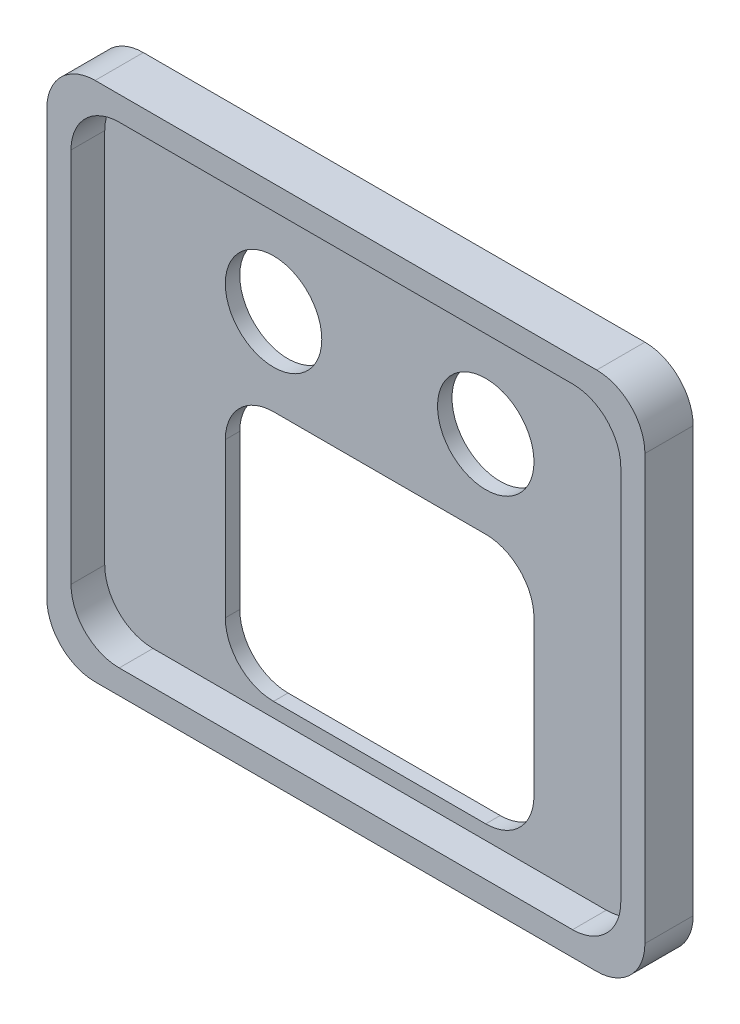
from build123d import *

# Parameters (mm, degrees)
EXTRUDE_1_DEPTH     = 10
CUT_EXTRUDE_1_DEPTH = 7
CUT_EXTRUDE_2_DEPTH = 7
SKETCH_4_R          = 10
CUT_EXTRUDE_3_DEPTH = 7


with BuildPart() as part:
    # 草图1 → 凸台-拉伸1 (new body)
    with BuildSketch(Plane.XY):
        with BuildLine():
            Line((10, 108), (114, 108))
            ThreePointArc((114, 108), (121.071067812, 105.071067812), (124, 98))
            Line((124, 98), (124, 10))
            ThreePointArc((124, 10), (121.071067812, 2.928932188), (114, 0))
            Line((114, 0), (10, 0))
            ThreePointArc((10, 0), (2.928932188, 2.928932188), (0, 10))
            Line((0, 10), (0, 98))
            ThreePointArc((0, 98), (2.928932188, 105.071067812), (10, 108))
        make_face()
    extrude(amount=EXTRUDE_1_DEPTH)

    # 草图2 → 切除-拉伸1 (cut)
    with BuildSketch(Plane.XY.offset(10)):
        with BuildLine():
            Line((15, 103), (109, 103))
            ThreePointArc((109, 103), (116.071067812, 100.071067812), (119, 93))
            Line((119, 93), (119, 15))
            ThreePointArc((119, 15), (116.071067812, 7.928932188), (109, 5))
            Line((109, 5), (15, 5))
            ThreePointArc((15, 5), (7.928932188, 7.928932188), (5, 15))
            Line((5, 15), (5, 93))
            ThreePointArc((5, 93), (7.928932188, 100.071067812), (15, 103))
        make_face()
    extrude(amount=-CUT_EXTRUDE_1_DEPTH, mode=Mode.SUBTRACT)

    # 草图3 → 切除-拉伸2 (cut)
    with BuildSketch(Plane(origin=(0, 0, 0), x_dir=(-1, 0, 0), z_dir=(0, 0, -1))):
        with BuildLine():
            Line((-84, 60), (-40, 60))
            ThreePointArc((-40, 60), (-32.928932188, 57.071067812), (-30, 50))
            Line((-30, 50), (-30, 18))
            ThreePointArc((-30, 18), (-32.928932188, 10.928932188), (-40, 8))
            Line((-40, 8), (-84, 8))
            ThreePointArc((-84, 8), (-91.071067812, 10.928932188), (-94, 18))
            Line((-94, 18), (-94, 50))
            ThreePointArc((-94, 50), (-91.071067812, 57.071067812), (-84, 60))
        make_face()
    extrude(amount=-CUT_EXTRUDE_2_DEPTH, mode=Mode.SUBTRACT)

    # 草图4 → 切除-拉伸3 (cut)
    with BuildSketch(Plane(origin=(0, 0, 0), x_dir=(-1, 0, 0), z_dir=(0, 0, -1))):
        with Locations((-84, 78)):
            Circle(SKETCH_4_R)
        with Locations((-40, 78)):
            Circle(SKETCH_4_R)
    extrude(amount=-CUT_EXTRUDE_3_DEPTH, mode=Mode.SUBTRACT)


solid = part.part
